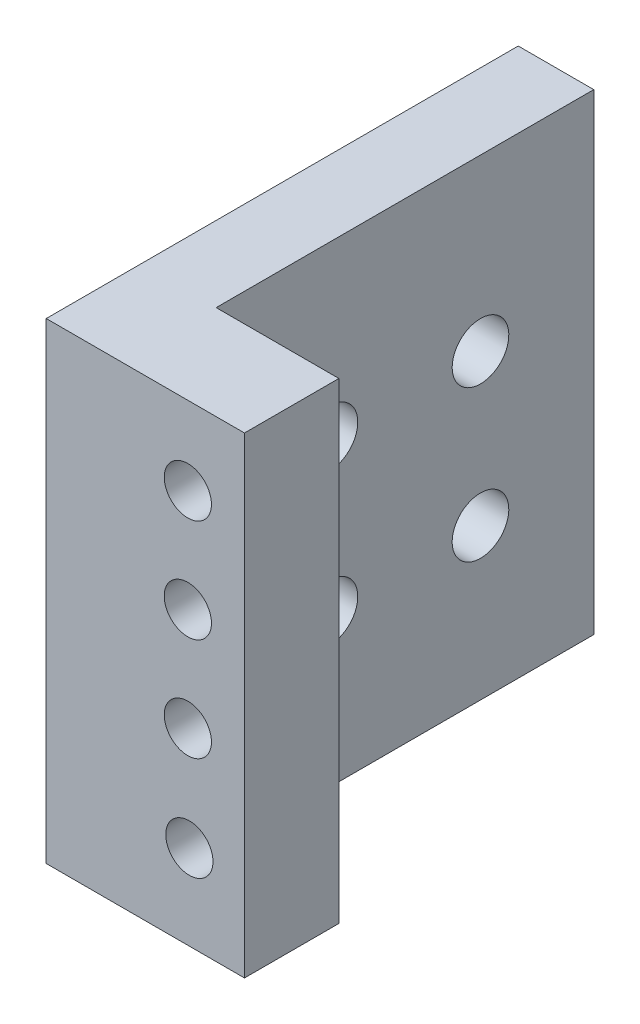
from build123d import *

# Parameters (mm, degrees)
SKETCH_1_R          = 1.25
EXTRUDE_1_DEPTH     = 5
SKETCH_2_W          = 5
SKETCH_2_H          = 25
EXTRUDE_2_DEPTH     = 4
SKETCH_3_W          = 4
SKETCH_3_H          = 25
EXTRUDE_3_DEPTH     = 20
SKETCH_4_R          = 1.5
CUT_EXTRUDE_1_DEPTH = 20


with BuildPart() as part:
    # 草图1 → 凸台-拉伸1 (new body)
    with BuildSketch(Plane.XY):
        Polygon((-3.581151343, -8.027992706), (-3.581151343, -12.611885422), (2.918848657, -12.611885422), (2.918848657, -6.641886627), (2.918848657, 12.388114578), (-3.581151343, 12.388114578), align=None)
        with Locations((-0.081151343, 8.237522913)):
            Circle(SKETCH_1_R, mode=Mode.SUBTRACT)
        with Locations((-0.081151343, 2.787522913)):
            Circle(SKETCH_1_R, mode=Mode.SUBTRACT)
        with Locations((-0.081151343, -2.662477087)):
            Circle(SKETCH_1_R, mode=Mode.SUBTRACT)
        with Locations((-0.000846901, -8.111885422)):
            Circle(SKETCH_1_R, mode=Mode.SUBTRACT)
    extrude(amount=EXTRUDE_1_DEPTH)

    # 草图2 → 凸台-拉伸2 (add)
    with BuildSketch(Plane.ZY.offset(3.581151343)):
        with Locations((2.5, -0.111885422)):
            Rectangle(SKETCH_2_W, SKETCH_2_H)
    extrude(amount=EXTRUDE_2_DEPTH)

    # 草图3 → 凸台-拉伸3 (add)
    with BuildSketch(Plane(origin=(0, 0, 0), x_dir=(-1, 0, 0), z_dir=(0, 0, -1))):
        with Locations((5.581151343, -0.111885422)):
            Rectangle(SKETCH_3_W, SKETCH_3_H)
    extrude(amount=EXTRUDE_3_DEPTH)

    # 草图4 → 切除-拉伸1 (cut)
    with BuildSketch(Plane(origin=(-3.581151343, 0, 0), x_dir=(0, 0, -1), z_dir=(1, 0, 0))):
        with Locations(Location((6, 3.388114578, 0), (0, 0, 90))):
            Circle(SKETCH_4_R)
        with Locations(Location((14, 3.388114578, 0), (0, 0, 180))):
            Circle(SKETCH_4_R)
        with Locations(Location((14, -4.611885422, 0), (0, 0, 90))):
            Circle(SKETCH_4_R)
        with Locations(Location((6, -4.611885422, 0), (0, 0, 180))):
            Circle(SKETCH_4_R)
    extrude(amount=-CUT_EXTRUDE_1_DEPTH, mode=Mode.SUBTRACT)


solid = part.part
